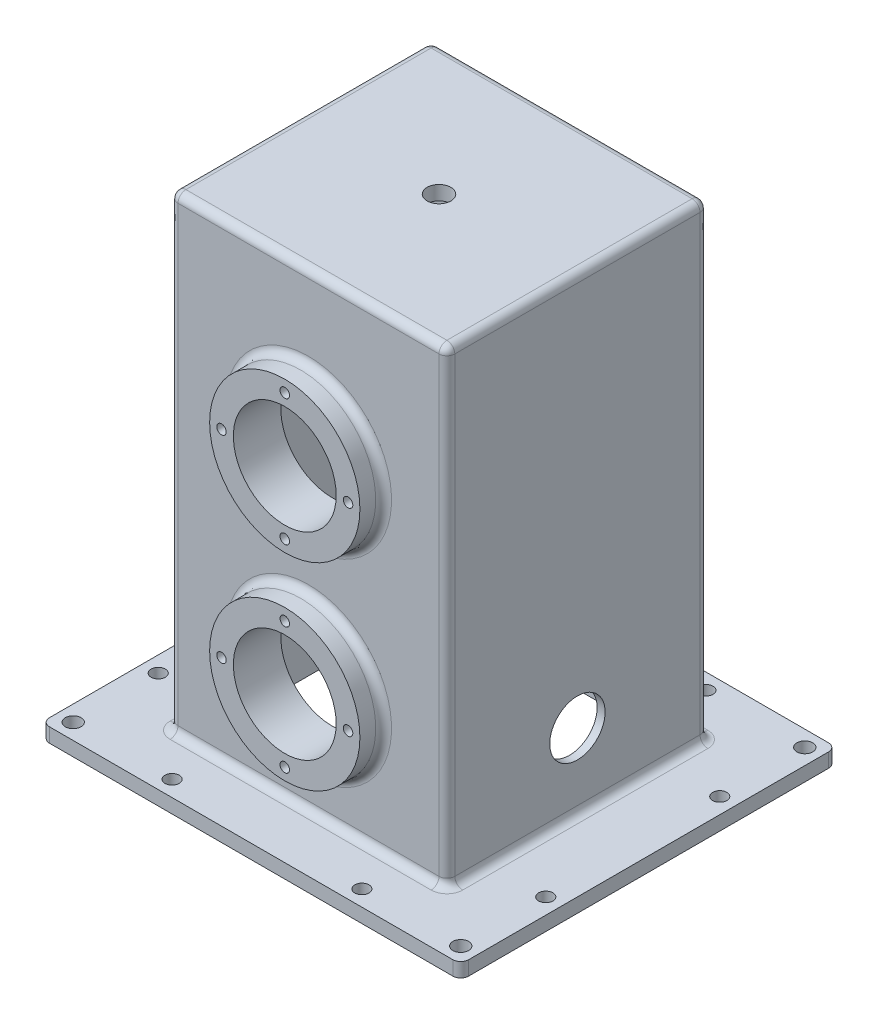
from build123d import *

# Parameters (mm, degrees)
SKETCH1_W           = 530
SKETCH1_H           = 475
BOSS_EXTRUDE1_DEPTH = 18
SKETCH2_W           = 350
SKETCH2_H           = 330
BOSS_EXTRUDE2_DEPTH = 592
SKETCH3_W           = 330
SKETCH3_H           = 310
CUT_EXTRUDE1_DEPTH  = 592
SKETCH4_R           = 10
SKETCH4_R_2         = 9
CUT_EXTRUDE2_DEPTH  = 707.20906961
SKETCH5_R           = 65
CUT_EXTRUDE3_DEPTH  = 778.387451661
SKETCH6_R           = 95
SKETCH6_R_2         = 65
BOSS_EXTRUDE4_DEPTH = 30
SKETCH8_R           = 6
CUT_EXTRUDE5_DEPTH  = 42
SKETCH9_R           = 6
CUT_EXTRUDE6_DEPTH  = 42
SKETCH10_R          = 15
CUT_EXTRUDE7_DEPTH  = 707.20906961
SKETCH11_R          = 35
CUT_EXTRUDE8_DEPTH  = 42
FILLET1_R           = 10
SKETCH12_R          = 6
CUT_EXTRUDE9_DEPTH  = 42


with BuildPart() as part:
    # Sketch1 → Boss-Extrude1 (new body)
    with BuildSketch(Plane(origin=(0, 0, 0), x_dir=(1, 0, 0), z_dir=(0, 1, 0))):
        Rectangle(SKETCH1_W, SKETCH1_H)
    extrude(amount=BOSS_EXTRUDE1_DEPTH)

    # Sketch2 → Boss-Extrude2 (add)
    with BuildSketch(Plane(origin=(0, 18, 0), x_dir=(1, 0, 0), z_dir=(0, 1, 0))):
        Rectangle(SKETCH2_W, SKETCH2_H)
    extrude(amount=BOSS_EXTRUDE2_DEPTH)

    # Sketch3 → Cut-Extrude1 (cut)
    with BuildSketch(Plane.XZ):
        Rectangle(SKETCH3_W, SKETCH3_H)
    extrude(amount=-CUT_EXTRUDE1_DEPTH, mode=Mode.SUBTRACT)

    # Sketch4 → Cut-Extrude2 (cut, through all)
    with BuildSketch(Plane.XZ):
        with Locations(Location((-245, 217.5, 0), (0, 0, 270))):
            Circle(SKETCH4_R)
        with Locations(Location((-120, 217.5, 0), (0, 0, 270))):
            Circle(SKETCH4_R_2)
        with Locations(Location((-245, 110, 0), (0, 0, 270))):
            Circle(SKETCH4_R_2)
        with Locations(Location((245, 110, 0), (0, 0, 270))):
            Circle(SKETCH4_R_2)
        with Locations(Location((120, 217.5, 0), (0, 0, 270))):
            Circle(SKETCH4_R_2)
        with Locations(Location((245, 217.5, 0), (0, 0, 270))):
            Circle(SKETCH4_R)
        with Locations(Location((245, -110, 0), (0, 0, 270))):
            Circle(SKETCH4_R_2)
        with Locations(Location((245, -217.5, 0), (0, 0, 270))):
            Circle(SKETCH4_R)
        with Locations(Location((120, -217.5, 0), (0, 0, 270))):
            Circle(SKETCH4_R_2)
        with Locations(Location((-120, -217.5, 0), (0, 0, 270))):
            Circle(SKETCH4_R_2)
        with Locations(Location((-245, -217.5, 0), (0, 0, 270))):
            Circle(SKETCH4_R)
        with Locations(Location((-245, -110, 0), (0, 0, 270))):
            Circle(SKETCH4_R_2)
    extrude(amount=-CUT_EXTRUDE2_DEPTH, mode=Mode.SUBTRACT)

    # Sketch5 → Cut-Extrude3 (cut, through all)
    with BuildSketch(Plane.XY.offset(165)):
        with Locations((0, 410)):
            Circle(SKETCH5_R)
        with Locations((0, 160)):
            Circle(SKETCH5_R)
    extrude(amount=-CUT_EXTRUDE3_DEPTH, mode=Mode.SUBTRACT)

    # Sketch6 → Boss-Extrude4 (add, symmetric)
    # profile 1 of 2: a face of its own
    with BuildSketch(Plane.XY.offset(165)):
        with Locations((0, 410)):
            Circle(SKETCH6_R)
        with Locations((0, 410)):
            Circle(SKETCH6_R_2, mode=Mode.SUBTRACT)
    # profile 2 of 2: a face of its own
    with BuildSketch(Plane.XY.offset(165)):
        with Locations((0, 160)):
            Circle(SKETCH6_R)
        with Locations((0, 160)):
            Circle(SKETCH6_R_2, mode=Mode.SUBTRACT)
    boss_extrude4 = extrude(amount=BOSS_EXTRUDE4_DEPTH, both=True)

    # Mirror1: Boss-Extrude4 across plane
    add(boss_extrude4.mirror(Plane.XY))

    # Sketch8 → Cut-Extrude5 (cut)
    with BuildSketch(Plane.XY.offset(195)):
        with Locations((0, 490)):
            Circle(SKETCH8_R)
        with Locations((80, 410)):
            Circle(SKETCH8_R)
        with Locations((0, 330)):
            Circle(SKETCH8_R)
        with Locations((-80, 410)):
            Circle(SKETCH8_R)
    extrude(amount=-CUT_EXTRUDE5_DEPTH, mode=Mode.SUBTRACT)

    # Sketch9 → Cut-Extrude6 (cut)
    with BuildSketch(Plane.XY.offset(195)):
        with Locations((0, 240)):
            Circle(SKETCH9_R)
        with Locations((80, 160)):
            Circle(SKETCH9_R)
        with Locations((0, 80)):
            Circle(SKETCH9_R)
        with Locations((-80, 160)):
            Circle(SKETCH9_R)
    extrude(amount=-CUT_EXTRUDE6_DEPTH, mode=Mode.SUBTRACT)

    # Sketch10 → Cut-Extrude7 (cut, through all)
    with BuildSketch(Plane(origin=(0, 610, 0), x_dir=(1, 0, 0), z_dir=(0, 1, 0))):
        with Locations(Location((0, 0, 0), (0, 0, 270))):
            Circle(SKETCH10_R)
    extrude(amount=-CUT_EXTRUDE7_DEPTH, mode=Mode.SUBTRACT)

    # Sketch11 → Cut-Extrude8 (cut)
    with BuildSketch(Plane(origin=(175, 0, 0), x_dir=(0, 0, -1), z_dir=(1, 0, 0))):
        with Locations((0, 113)):
            Circle(SKETCH11_R)
    extrude(amount=-CUT_EXTRUDE8_DEPTH, mode=Mode.SUBTRACT)

    # Fillet1
    fillet1_edges = [part.edges().sort_by_distance(p)[0] for p in [
        (-95, 410, 165),
        (-95, 160, 165),
        (175, 18, 0),
        (175, 314, 165),
        (0, 18, -165),
        (-95, 410, -165),
        (175, 314, -165),
        (-175, 18, 0),
        (-175, 314, -165),
        (0, 18, 165),
        (-95, 160, -165),
        (-175, 314, 165),
        (175, 610, 0),
        (0, 610, -165),
        (-175, 610, 0),
        (0, 610, 165),
        (265, 9, 237.5),
        (-265, 9, 237.5),
        (-265, 9, -237.5),
        (265, 9, -237.5),
    ]]
    fillet(fillet1_edges, radius=FILLET1_R)

    # Sketch12 → Cut-Extrude9 (cut)
    with BuildSketch(Plane(origin=(0, 0, -195), x_dir=(-1, 0, 0), z_dir=(0, 0, -1))):
        with Locations((-0.00921784, 240.011349017)):
            Circle(SKETCH12_R)
        with Locations((79.99078216, 160.011349017)):
            Circle(SKETCH12_R)
        with Locations((-0.00921784, 80.011349017)):
            Circle(SKETCH12_R)
        with Locations((-80.00921784, 160.011349017)):
            Circle(SKETCH12_R)
        with Locations((0.020793884, 489.947358351)):
            Circle(SKETCH12_R)
        with Locations((80.020793884, 409.947358351)):
            Circle(SKETCH12_R)
        with Locations((0.020793884, 329.947358351)):
            Circle(SKETCH12_R)
        with Locations((-79.979206116, 409.947358351)):
            Circle(SKETCH12_R)
    extrude(amount=-CUT_EXTRUDE9_DEPTH, mode=Mode.SUBTRACT)


solid = part.part
